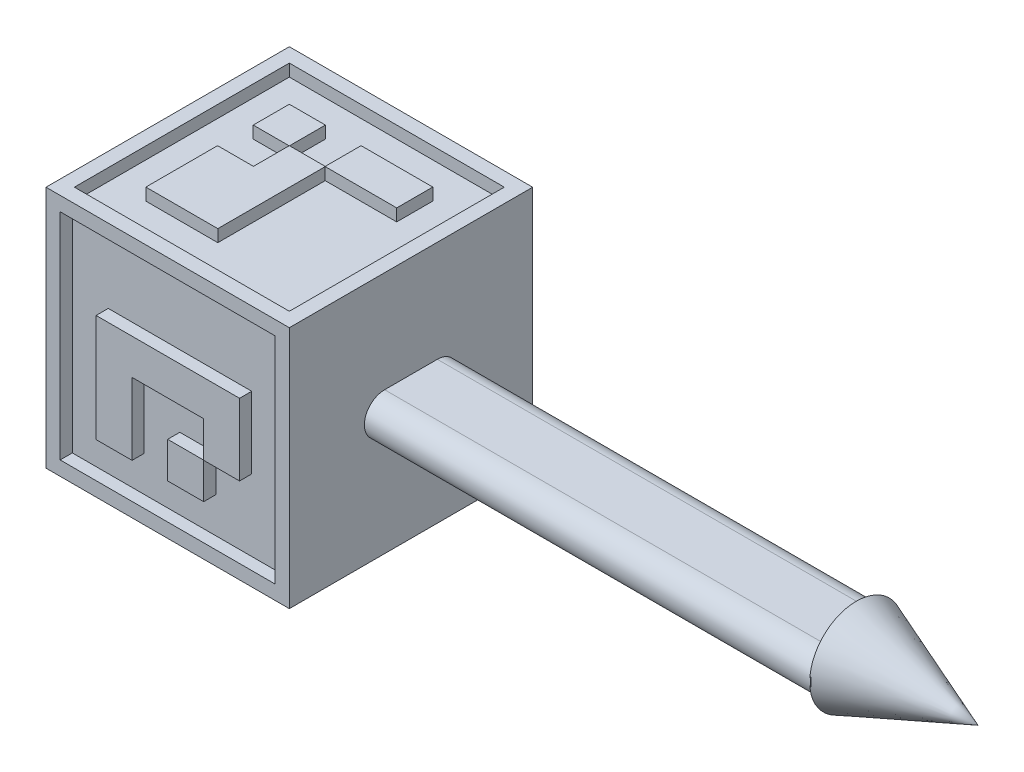
from build123d import *

# Parameters (mm, degrees)
ESTRUSIONE_ESTRUSIONE1_DEPTH = 170
SCHIZZO5_W                   = 60
SCHIZZO5_H                   = 60
ESTRUSIONE_ESTRUSIONE2_DEPTH = 60
TAGLIO_ESTRUSIONE10_DEPTH    = 3
TAGLIO_ESTRUSIONE11_DEPTH    = 3
TAGLIO_ESTRUSIONE13_DEPTH    = 3
TAGLIO_ESTRUSIONE14_DEPTH    = 3
TAGLIO_ESTRUSIONE15_DEPTH    = 3


with BuildPart() as part:
    # Schizzo3 → Estrusione-Estrusione1 (new body)
    with BuildSketch(Plane(origin=(0, 0, 0), x_dir=(0, 0, -1), z_dir=(1, 0, 0))):
        with BuildLine():
            Line((-6.5, 5), (6.5, 5))
            ThreePointArc((6.5, 5), (11.5, 0), (6.5, -5))
            Line((6.5, -5), (-6.5, -5))
            ThreePointArc((-6.5, -5), (-11.5, 0), (-6.5, 5))
        make_face()
    extrude(amount=ESTRUSIONE_ESTRUSIONE1_DEPTH)

    # Schizzo5 → Estrusione-Estrusione2 (add)
    with BuildSketch(Plane(origin=(0, 0, 0), x_dir=(0, 0, -1), z_dir=(1, 0, 0))):
        Rectangle(SCHIZZO5_W, SCHIZZO5_H)
    extrude(amount=ESTRUSIONE_ESTRUSIONE2_DEPTH)

    # Schizzo3D7 → Taglio-Estrusione10 (cut)
    with BuildSketch(Plane(origin=(56.509252896, 26.505952129, -30), x_dir=(-0.7071372191638572, -0.7070763418989545, 0), z_dir=(0, 0, -1))):
        Polygon((0, 0), (37.480879661, 37.477652941), (74.95530616, 0), (37.4744265, -37.477652941), align=None)
        Polygon((12.549447187, -0.041107367), (18.763393239, 6.172303729), (31.2103731, -6.275747782), (24.996427048, -12.489158877), align=None, mode=Mode.SUBTRACT)
        Polygon((43.745393177, -18.806291324), (56.229474498, -6.323284754), (43.697232303, 6.210036431), (49.973132388, 12.485396224), (37.487721799, 24.971881772), (31.196030757, 18.680732379), (43.681441346, 6.194246832), (37.487382187, 0.000720919), (43.730669214, -6.243103637), (37.456438009, -12.516794695), align=None, mode=Mode.SUBTRACT)
    extrude(amount=-TAGLIO_ESTRUSIONE10_DEPTH, mode=Mode.SUBTRACT)

    # Schizzo3D9 → Taglio-Estrusione11 (cut)
    with BuildSketch(Plane(origin=(3.48896397, 30, -26.510632889), x_dir=(0.7071079856740462, 0, 0.7071055766969973), z_dir=(0, -1, 0))):
        Polygon((0, 0), (37.477803778, 37.478791667), (74.95758336, 0), (37.479779582, -37.478791667), align=None)
        Polygon((12.43579878, 0.00203054), (18.724902507, -6.286907414), (24.978062752, -0.033582341), (31.199748191, -6.255103785), (24.946587946, -12.508428859), (37.447554582, -25.009065987), (43.737305453, -18.719149323), (31.273888011, -6.256060399), (50.001148896, 12.471694123), (37.452810535, 25.019701726), (24.946652169, 12.513213707), (31.199675089, 6.260355607), (24.978572571, 0.039089105), (18.72554965, 6.291947204), align=None, mode=Mode.SUBTRACT)
    extrude(amount=TAGLIO_ESTRUSIONE11_DEPTH, mode=Mode.SUBTRACT)

    # Schizzo3D10 → Taglio-Estrusione13 (cut)
    # profile 1 of 2: a face of its own
    with BuildSketch(Plane(origin=(3.488655303, -30, 26.510146491), x_dir=(0.7071145512231992, 0, -0.7070990110645141), z_dir=(0, -1, 0))):
        Polygon((0, 0), (37.477604433, -37.478428091), (74.9568562, 0), (37.479251767, 37.478428091), align=None)
        Polygon((25.052273044, -0.034278035), (18.80084393, -6.285569762), (12.515044966, 0.000367348), (18.806420078, 6.291604196), (25.070142969, 0.027743646), (31.248306687, 6.205771587), (24.984583796, 12.469632138), (37.530042105, 25.014814736), (56.292018249, 6.252426254), (50.041865549, 0.002410912), (56.299922917, -6.255783991), (50.023820889, -12.531748091), (37.509650627, -0.0173028), (31.272337329, -6.254479021), align=None, mode=Mode.SUBTRACT)
    # profile 2 of 2: a face of its own
    with BuildSketch(Plane(origin=(3.488655303, -30, 26.510146491), x_dir=(0.7071145512231992, 0, -0.7070990110645141), z_dir=(0, -1, 0))):
        Polygon((37.496799303, 0.036168583), (31.312223937, 6.22087987), (37.528934609, 12.437453919), (43.720930387, 6.245322057), (37.504355954, 0.028884245), align=None)
    extrude(amount=-TAGLIO_ESTRUSIONE13_DEPTH, mode=Mode.SUBTRACT)

    # Schizzo3D11 → Taglio-Estrusione14 (cut)
    with BuildSketch(Plane(origin=(3.48761134, -26.495070277, 30), x_dir=(0.7071106609809186, 0.7071029013708885, 0), z_dir=(0, 0, 1))):
        Polygon((0, 0), (37.47640364, 37.476814899), (74.953629802, 0), (37.477226162, -37.476814899), align=None)
        Polygon((12.483616576, -0.053090758), (31.219303961, 18.682802228), (56.228931149, -6.326550512), (43.738644318, -18.816974409), (37.483135519, -12.561534256), (31.226265699, -18.818472739), (24.950948382, -12.543224286), (31.235576896, -6.258526806), (37.476342879, -12.499224305), (43.722678491, -6.252820147), (31.274462582, 6.195259158), (18.743498457, -6.335842479), (12.472147309, -0.064560151), align=None, mode=Mode.SUBTRACT)
    extrude(amount=-TAGLIO_ESTRUSIONE14_DEPTH, mode=Mode.SUBTRACT)

    # Schizzo3D12 → Taglio-Estrusione15 (cut)
    with BuildSketch(Plane(origin=(0, 26.510328561, -26.510258091), x_dir=(0, -0.7071155777670133, 0.707097984496649), z_dir=(-1, 0, 0))):
        Polygon((0, 0), (37.478907887, -37.477975399), (74.955950822, 0), (37.477042935, 37.477975399), align=None)
        Polygon((12.548610555, -0.039984823), (25.020040578, 12.431755501), (25.039803863, 12.451519277), (31.26096878, 6.230509145), (43.750153238, 18.720004346), (49.98040082, 12.489911774), (37.491216362, 0.000416573), (31.296299436, 6.195179367), (25.059044147, -0.04223111), (37.492371823, -12.475249441), (43.729627112, -6.237838964), (50.02267626, -12.530731538), (43.748911666, -18.804652229), (37.493935145, -12.549831334), (31.237084407, -18.806837749), (12.509188531, -0.079407829), align=None, mode=Mode.SUBTRACT)
        Polygon((49.927796206, -0.045447197), (56.217879582, -6.335374073), (62.511860718, -0.041236337), (56.221777342, 6.248690539), align=None, mode=Mode.SUBTRACT)
    extrude(amount=-TAGLIO_ESTRUSIONE15_DEPTH, mode=Mode.SUBTRACT)


with BuildPart() as body_2:
    # Schizzo8 → Rivoluzione1 (revolve)
    with BuildSketch(Plane(origin=(-2.00656725, 0, 0), x_dir=(1, 0, 0), z_dir=(0, 1, 0))):
        Polygon((171.810987293, 0), (201.810987293, 0), (171.810987293, -11.5), align=None)
    revolve(axis=Axis((169.804420043, 0, 0), (1, 0, 0)))


solid = Compound([part.part, body_2.part])
